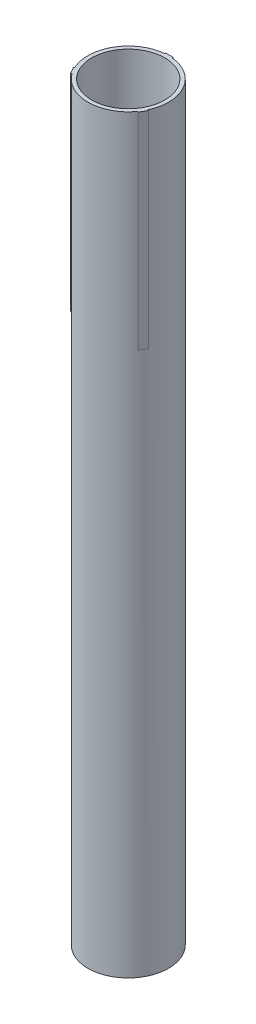
from build123d import *

# Parameters (mm, degrees)
ESBO_O1_R                = 21.5
ESBO_O1_R_2              = 19.5
RESSALTO_EXTRUS_O1_DEPTH = 400
RESSALTO_EXTRUS_O3_DEPTH = 110
PADR_OCIRCULAR2_COUNT    = 3


with BuildPart() as part:
    # Esboço1 → Ressalto-extrusão1 (new body)
    with BuildSketch(Plane(origin=(0, 0, 0), x_dir=(1, 0, 0), z_dir=(0, 1, 0))):
        with Locations(Location((0, 0, 0), (0, 0, 270))):
            Circle(ESBO_O1_R)
        with Locations(Location((0, 0, 0), (0, 0, 270))):
            Circle(ESBO_O1_R_2, mode=Mode.SUBTRACT)
    extrude(amount=RESSALTO_EXTRUS_O1_DEPTH)

    # Esboço2 → Ressalto-extrusão3 (add)
    with BuildSketch(Plane(origin=(0, 400, 0), x_dir=(1, 0, 0), z_dir=(0, 1, 0))):
        Polygon((2, 21.930506272), (2, 21.234864033), (0, 21.5), (-1.998917515, 21.234864033), (-1.998917515, 21.930506272), align=None)
    ressalto_extrus_o3 = extrude(amount=-RESSALTO_EXTRUS_O3_DEPTH)

    # PadrãoCircular2: Ressalto-extrusão3 ×3 about axis
    padr_ocircular2_axis = Axis((0, 0, 0), (0, 1, 0))
    for i in range(1, PADR_OCIRCULAR2_COUNT):
        add(ressalto_extrus_o3.rotate(padr_ocircular2_axis, i * 360 / PADR_OCIRCULAR2_COUNT))


solid = part.part
